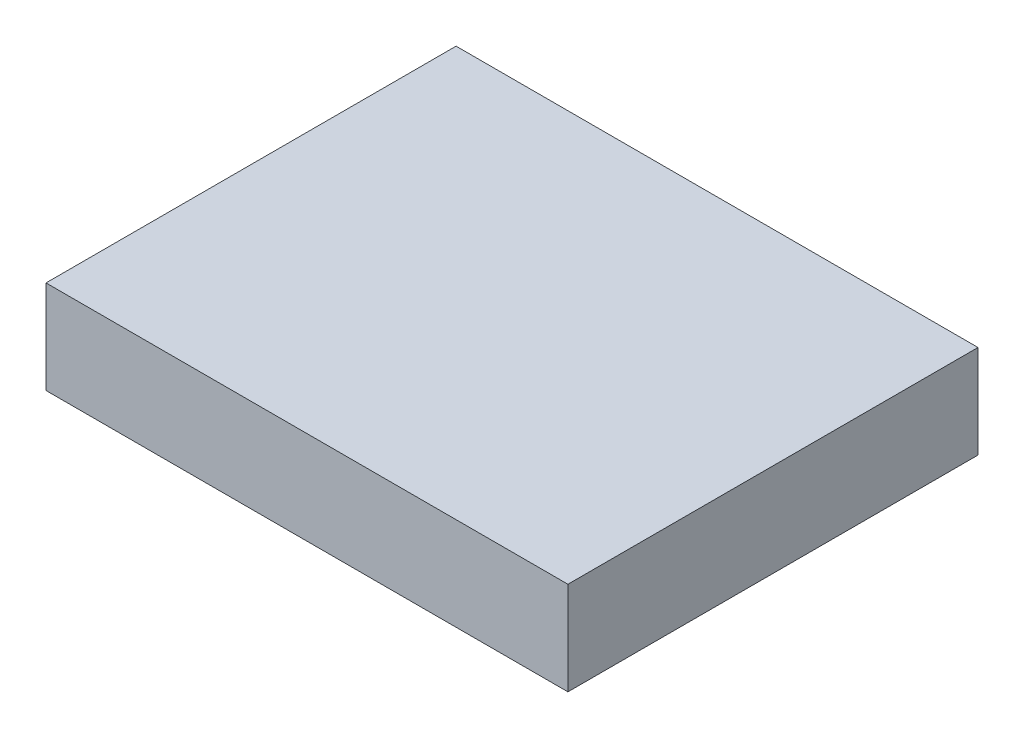
from build123d import *

# Parameters (mm, degrees)
SKETCH2_W           = 711.2
SKETCH2_H           = 558.8
BOSS_EXTRUDE1_DEPTH = 127


with BuildPart() as part:
    # Sketch2 → Boss-Extrude1 (new body)
    with BuildSketch(Plane(origin=(0, 0, 0), x_dir=(1, 0, 0), z_dir=(0, 1, 0))):
        Rectangle(SKETCH2_W, SKETCH2_H)
    extrude(amount=BOSS_EXTRUDE1_DEPTH)


solid = part.part
